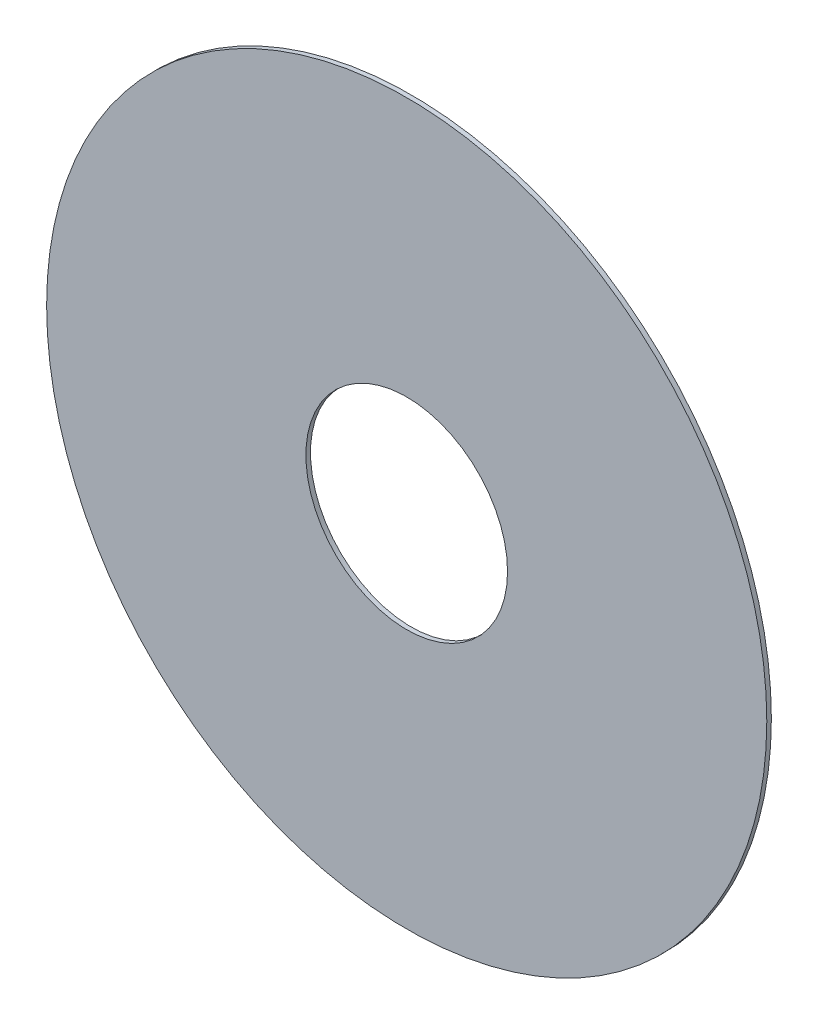
from build123d import *

# Parameters (mm, degrees)
SKETCH1_R           = 250
BOSS_EXTRUDE2_DEPTH = 3.175
SKETCH2_R           = 70
CUT_EXTRUDE1_DEPTH  = 3.175


with BuildPart() as part:
    # Sketch1 → Boss-Extrude2 (new body)
    with BuildSketch(Plane.XY):
        Circle(SKETCH1_R)
    extrude(amount=BOSS_EXTRUDE2_DEPTH)

    # Sketch2 → Cut-Extrude1 (cut)
    with BuildSketch(Plane.XY.offset(3.175)):
        Circle(SKETCH2_R)
    extrude(amount=-CUT_EXTRUDE1_DEPTH, mode=Mode.SUBTRACT)


solid = part.part
